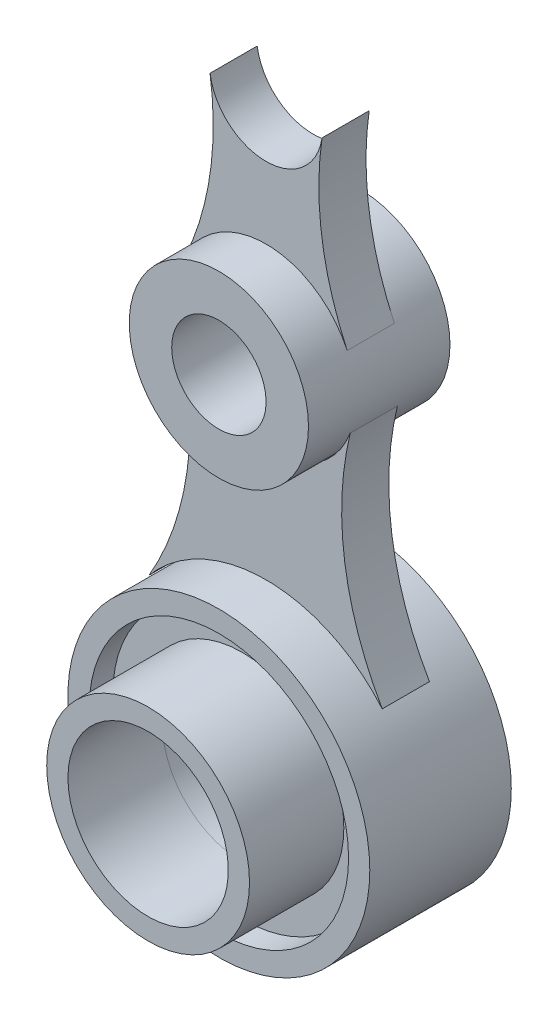
from build123d import *

# Parameters (mm, degrees)
SKETCH2_R             = 19
BOSS_EXTRUDE1_DEPTH   = 30
SKETCH2_R_2           = 32
BOSS_EXTRUDE1_2_DEPTH = 30
BOSS_EXTRUDE2_DEPTH   = 10
SKETCH4_R             = 27.5
CUT_EXTRUDE1_DEPTH    = 5
SKETCH5_R             = 21.5
BOSS_EXTRUDE3_DEPTH   = 20
SKETCH6_R             = 17
SKETCH6_R_2           = 10
CUT_EXTRUDE2_DEPTH    = 113.3371596


with BuildPart() as part:
    # Sketch2 → Boss-Extrude1 (new body)
    with BuildSketch(Plane.XY):
        with Locations((3.857754872, 52.067565658)):
            Circle(SKETCH2_R)
    extrude(amount=BOSS_EXTRUDE1_DEPTH)

    # Sketch3 → Boss-Extrude2 (add)
    with BuildSketch(Plane.XY.offset(10)):
        with BuildLine():
            ThreePointArc((28.499357068, -1.97501589), (20.541861527, 20.988265898), (21.719409946, 45.262685056))
            ThreePointArc((21.719409946, 45.262685056), (3.670693383, 32.954477734), (-14.133665881, 45.613582293))
            ThreePointArc((-14.133665881, 45.613582293), (-12.871979086, 21.030531271), (-20.982159168, -2.210450425))
            ThreePointArc((-20.982159168, -2.210450425), (3.703841741, 9.415645319), (28.499357068, -1.97501589))
        make_face()
        with BuildLine():
            ThreePointArc((-13.355964266, 60.110442845), (3.857754872, 71.067565658), (21.07147401, 60.110442845))
            ThreePointArc((21.07147401, 60.110442845), (15.73347068, 77.904728914), (15.730929568, 96.482427636))
            ThreePointArc((15.730929568, 96.482427636), (3.857754872, 86.222462877), (-8.015419824, 96.482427636))
            ThreePointArc((-8.015419824, 96.482427636), (-8.017960936, 77.904728914), (-13.355964266, 60.110442845))
        make_face()
    extrude(amount=BOSS_EXTRUDE2_DEPTH)


with BuildPart() as body_2:
    # Sketch2 → Boss-Extrude1 2 (new body)
    with BuildSketch(Plane.XY):
        with Locations((3.857754872, -22.932434342)):
            Circle(SKETCH2_R_2)
    extrude(amount=BOSS_EXTRUDE1_2_DEPTH)

    # Sketch4 → Cut-Extrude1 (cut)
    with BuildSketch(Plane.XY.offset(25)):
        with Locations((3.857754872, -22.932434342)):
            Circle(SKETCH4_R)
    extrude(amount=CUT_EXTRUDE1_DEPTH, mode=Mode.SUBTRACT)


with BuildPart() as boss_extrude2_piece_1:
    # of the separate pieces the step leaves, piece 1, a body of its own (boss_extrude2_pieces)
    add(part.part.solids().sort_by_distance((22.857754872, 52.067565658, 0))[0])


with BuildPart() as boss_extrude2_piece_2:
    # of the separate pieces the step leaves, piece 2, a body of its own (boss_extrude2_pieces)
    add(part.part.solids().sort_by_distance((-14.133665881, 45.613582293, 10))[0])


with BuildPart() as body_4:
    # Sketch5 → Boss-Extrude3 (new body)
    with BuildSketch(Plane.XY.offset(25)):
        with Locations((3.857754872, -22.932434342)):
            Circle(SKETCH5_R)
    extrude(amount=BOSS_EXTRUDE3_DEPTH)


with BuildPart() as cut_extrude2_tool:
    # Sketch6 → Cut-Extrude2 (new, through all)
    with BuildSketch(Plane.XY):
        with Locations(Location((3.857754872, -22.932434342, 0), (0, 0, 180))):
            Circle(SKETCH6_R)
        with Locations(Location((3.857754872, 52.067565658, 0), (0, 0, 180))):
            Circle(SKETCH6_R_2)
    extrude(amount=CUT_EXTRUDE2_DEPTH)


with BuildPart() as body_2_1:
    add(body_2.part)

    # Cut-Extrude2: cut by cut_extrude2_tool
    add(cut_extrude2_tool.part, mode=Mode.SUBTRACT)


with BuildPart() as boss_extrude2_piece_1_1:
    add(boss_extrude2_piece_1.part)

    # Cut-Extrude2: cut by cut_extrude2_tool
    add(cut_extrude2_tool.part, mode=Mode.SUBTRACT)


with BuildPart() as body_4_1:
    add(body_4.part)

    # Cut-Extrude2: cut by cut_extrude2_tool
    add(cut_extrude2_tool.part, mode=Mode.SUBTRACT)


solid = Compound([boss_extrude2_piece_2.part, body_2_1.part, boss_extrude2_piece_1_1.part, body_4_1.part])
